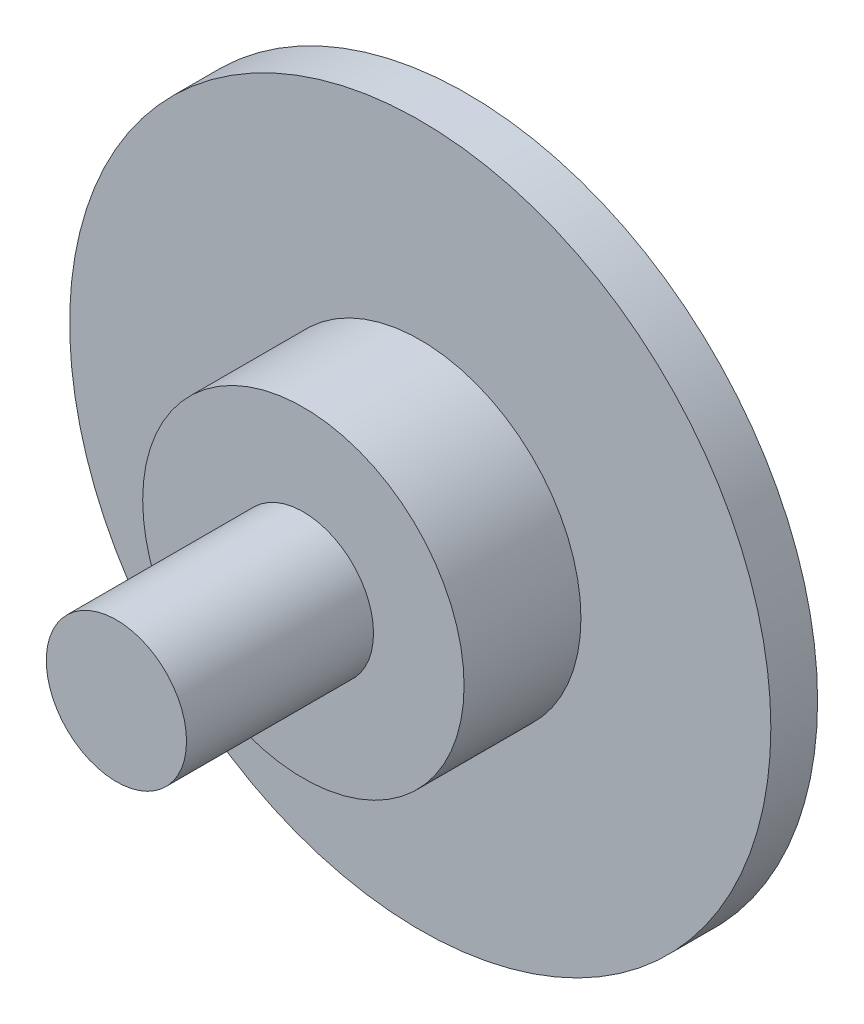
from build123d import *

# Parameters (mm, degrees)
SKETCH1_R           = 15
BOSS_EXTRUDE1_DEPTH = 2
SKETCH2_R           = 6.875
BOSS_EXTRUDE2_DEPTH = 5
SKETCH3_R           = 3
BOSS_EXTRUDE3_DEPTH = 8


with BuildPart() as part:
    # Sketch1 → Boss-Extrude1 (new body)
    with BuildSketch(Plane.XY):
        Circle(SKETCH1_R)
    extrude(amount=BOSS_EXTRUDE1_DEPTH)

    # Sketch2 → Boss-Extrude2 (add)
    with BuildSketch(Plane.XY.offset(2)):
        Circle(SKETCH2_R)
    extrude(amount=BOSS_EXTRUDE2_DEPTH)

    # Sketch3 → Boss-Extrude3 (add)
    with BuildSketch(Plane.XY.offset(7)):
        Circle(SKETCH3_R)
    extrude(amount=BOSS_EXTRUDE3_DEPTH)


solid = part.part
